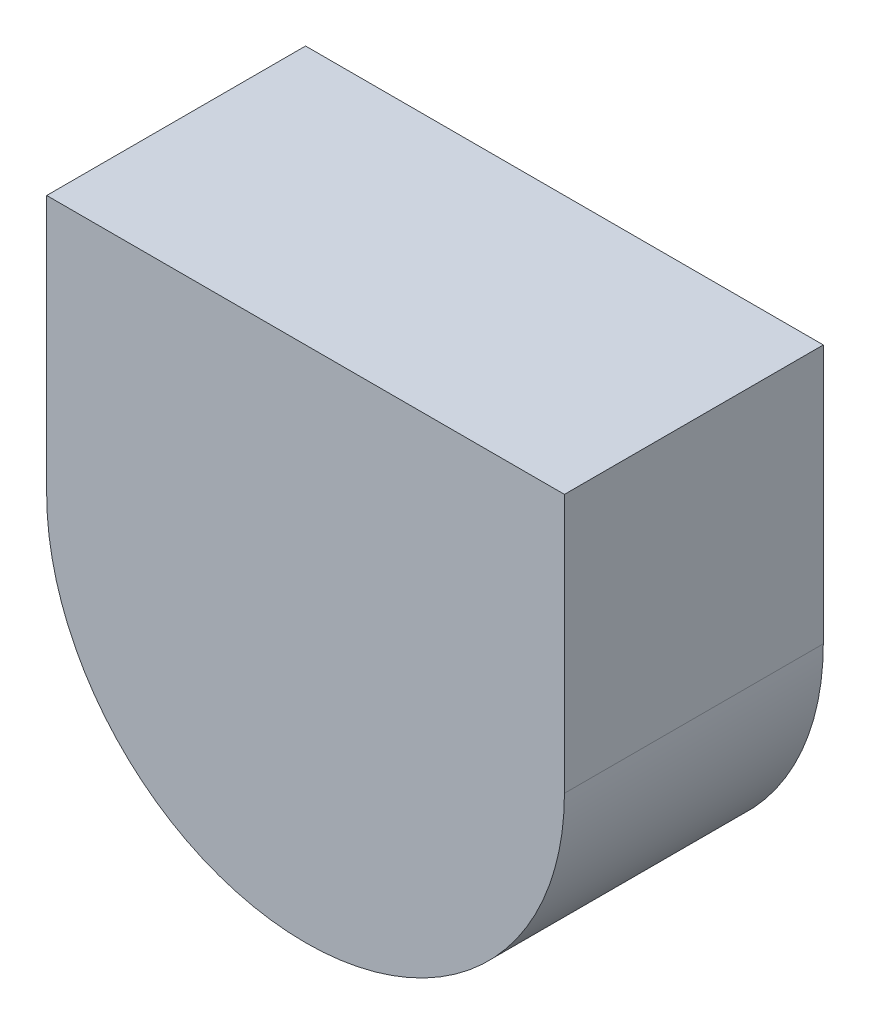
from build123d import *

# Parameters (mm, degrees)
BOSS_EXTRUDE1_DEPTH = 2.54


with BuildPart() as part:
    # Sketch1 → Boss-Extrude1 (new body)
    with BuildSketch(Plane.XY):
        with BuildLine():
            Line((-2.54, 2.54), (-2.54, 0))
            ThreePointArc((-2.54, 0), (0, -2.54), (2.54, 0))
            Line((2.54, 0), (2.54, 2.54))
            Line((2.54, 2.54), (-2.54, 2.54))
        make_face()
    extrude(amount=BOSS_EXTRUDE1_DEPTH)


solid = part.part
